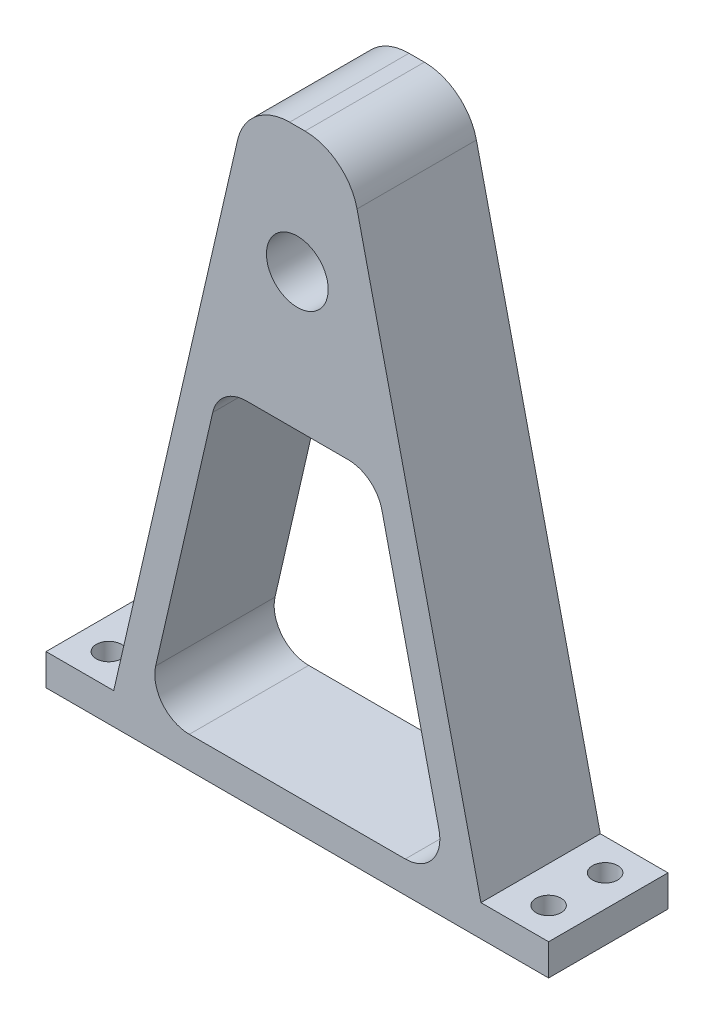
from build123d import *

# Parameters (mm, degrees)
BOSS_EXTRUDE1_DEPTH            = 12
BOSS_EXTRUDE1_DEPTH_BACK       = 7
SKETCH1_R                      = 4.915
BOSS_EXTRUDE2_DEPTH            = 12
BOSS_EXTRUDE2_DEPTH_BACK       = 7
SKETCH1_3_W                    = 80
SKETCH1_3_H                    = 5
CUT_EXTRUDE1_REACH             = 103.367
SKETCH2_R                      = 2
CUT_EXTRUDE2_REACH             = 67.146
CUT_EXTRUDE2_DIRECTION_2_REACH = 67.146
FILLET3_R                      = 8.5
FILLET4_R                      = 5.5


with BuildPart() as part:
    # Sketch1 → Boss-Extrude1 (new, two sides: drawn at the far end of the back side and taken through both)
    with BuildSketch(Plane.XY.offset(-BOSS_EXTRUDE1_DEPTH_BACK)):
        Polygon((7.991845682, 47.36466233), (-7.991845682, 47.36466233), (-29.227261436, -45), (29.227261436, -45), align=None)
        with Locations((0, 27.36466233)):
            Circle(SKETCH1_R, mode=Mode.SUBTRACT)
    extrude(amount=BOSS_EXTRUDE1_DEPTH + BOSS_EXTRUDE1_DEPTH_BACK)

    # Sketch1<3> → Boss-Extrude2 (add, two sides: drawn at the far end of the back side and taken through both)
    with BuildSketch(Plane.XY.offset(-BOSS_EXTRUDE2_DEPTH_BACK)):
        with Locations((0, -47.5)):
            Rectangle(SKETCH1_3_W, SKETCH1_3_H)
    extrude(amount=BOSS_EXTRUDE2_DEPTH + BOSS_EXTRUDE2_DEPTH_BACK)

    # Sketch2 → Cut-Extrude1 (cut, up to next)
    with BuildSketch(Plane(origin=(0, -45, 0), x_dir=(1, 0, 0), z_dir=(0, 1, 0)), mode=Mode.PRIVATE) as cut_extrude1_sk1:
        with Locations(Location((-35, 2, 0), (0, 0, 270))):
            Circle(SKETCH2_R)
    cut_extrude1_tool1 = extrude(cut_extrude1_sk1.sketch, amount=-CUT_EXTRUDE1_REACH, mode=Mode.PRIVATE) & part.part
    # Sketch2 → Cut-Extrude1 (cut, up to next)
    with BuildSketch(Plane(origin=(0, -45, 0), x_dir=(1, 0, 0), z_dir=(0, 1, 0)), mode=Mode.PRIVATE) as cut_extrude1_sk2:
        with Locations(Location((-35, -7, 0), (0, 0, 270))):
            Circle(SKETCH2_R)
    cut_extrude1_tool2 = extrude(cut_extrude1_sk2.sketch, amount=-CUT_EXTRUDE1_REACH, mode=Mode.PRIVATE) & part.part
    # Sketch2 → Cut-Extrude1 (cut, up to next)
    with BuildSketch(Plane(origin=(0, -45, 0), x_dir=(1, 0, 0), z_dir=(0, 1, 0)), mode=Mode.PRIVATE) as cut_extrude1_sk3:
        with Locations(Location((35, 2, 0), (0, 0, 270))):
            Circle(SKETCH2_R)
    cut_extrude1_tool3 = extrude(cut_extrude1_sk3.sketch, amount=-CUT_EXTRUDE1_REACH, mode=Mode.PRIVATE) & part.part
    # Sketch2 → Cut-Extrude1 (cut, up to next)
    with BuildSketch(Plane(origin=(0, -45, 0), x_dir=(1, 0, 0), z_dir=(0, 1, 0)), mode=Mode.PRIVATE) as cut_extrude1_sk4:
        with Locations(Location((35, -7, 0), (0, 0, 270))):
            Circle(SKETCH2_R)
    cut_extrude1_tool4 = extrude(cut_extrude1_sk4.sketch, amount=-CUT_EXTRUDE1_REACH, mode=Mode.PRIVATE) & part.part
    add(cut_extrude1_tool1.solids().sort_by_distance((-35, -45, -2))[0], mode=Mode.SUBTRACT)
    add(cut_extrude1_tool2.solids().sort_by_distance((-35, -45, 7))[0], mode=Mode.SUBTRACT)
    add(cut_extrude1_tool3.solids().sort_by_distance((35, -45, -2))[0], mode=Mode.SUBTRACT)
    add(cut_extrude1_tool4.solids().sort_by_distance((35, -45, 7))[0], mode=Mode.SUBTRACT)

    # Sketch3 → Cut-Extrude2 (cut, up to next)
    with BuildSketch(Plane.XY, mode=Mode.PRIVATE) as cut_extrude2_sk1:
        Polygon((-12.48657179, 5.499434813), (12.48657179, 5.499434813), (24.096818248, -45), (-24.096818248, -45), align=None)
    cut_extrude2_tool1 = extrude(cut_extrude2_sk1.sketch, amount=-CUT_EXTRUDE2_REACH, mode=Mode.PRIVATE) & part.part
    add(cut_extrude2_tool1.solids().sort_by_distance((0, -22.421399, 0))[0], mode=Mode.SUBTRACT)

    # Sketch3 → Cut-Extrude2 direction 2 (cut, up to next)
    with BuildSketch(Plane.XY, mode=Mode.PRIVATE) as cut_extrude2_direction_2_sk1:
        Polygon((-12.48657179, 5.499434813), (12.48657179, 5.499434813), (24.096818248, -45), (-24.096818248, -45), align=None)
    cut_extrude2_direction_2_tool1 = extrude(cut_extrude2_direction_2_sk1.sketch, amount=CUT_EXTRUDE2_DIRECTION_2_REACH, mode=Mode.PRIVATE) & part.part
    add(cut_extrude2_direction_2_tool1.solids().sort_by_distance((0, -22.421399, 0))[0], mode=Mode.SUBTRACT)

    # Fillet3
    fillet3_edges = [part.edges().sort_by_distance(p)[0] for p in [
        (-7.991845682, 47.36466233, 2.5),
        (7.991845682, 47.36466233, 2.5),
    ]]
    fillet(fillet3_edges, radius=FILLET3_R)

    # Fillet4
    fillet4_edges = [part.edges().sort_by_distance(p)[0] for p in [
        (-12.48657179, 5.499434813, 2.5),
        (-24.096818248, -45, 2.5),
        (24.096818248, -45, 2.5),
        (12.48657179, 5.499434813, 2.5),
    ]]
    fillet(fillet4_edges, radius=FILLET4_R)


solid = part.part
